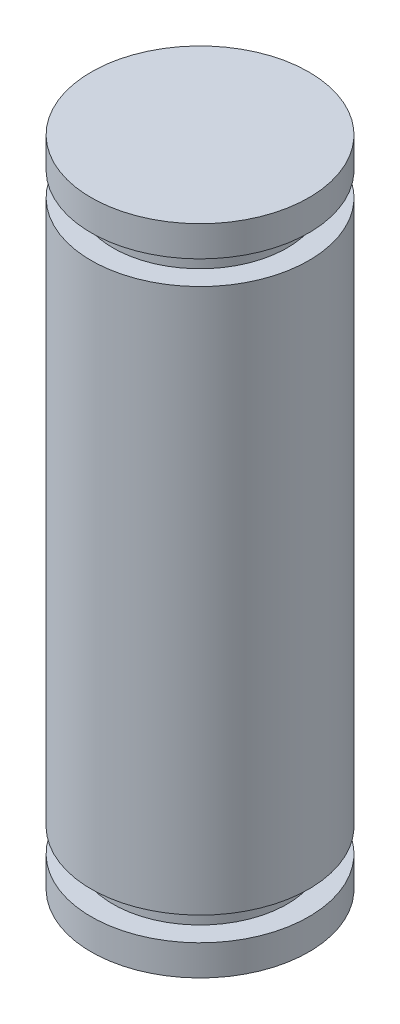
from build123d import *


with BuildPart() as part:
    # 草图1 → 旋转1 (revolve)
    with BuildSketch(Plane.XY, mode=Mode.PRIVATE) as revolve_1_sk:
        Polygon((0, 0), (-5, 0), (-5, 1.4), (-4, 1.4), (-4, 2.5), (-5, 2.5), (-5, 27.5), (-4, 27.5), (-4, 28.6), (-5, 28.6), (-5, 30), (0, 30), align=None)
    revolve(revolve_1_sk.sketch.rotate(Axis((0, 0, 0), (0, 1, 0)), 270), axis=Axis((0, 0, 0), (0, 1, 0)))


solid = part.part
